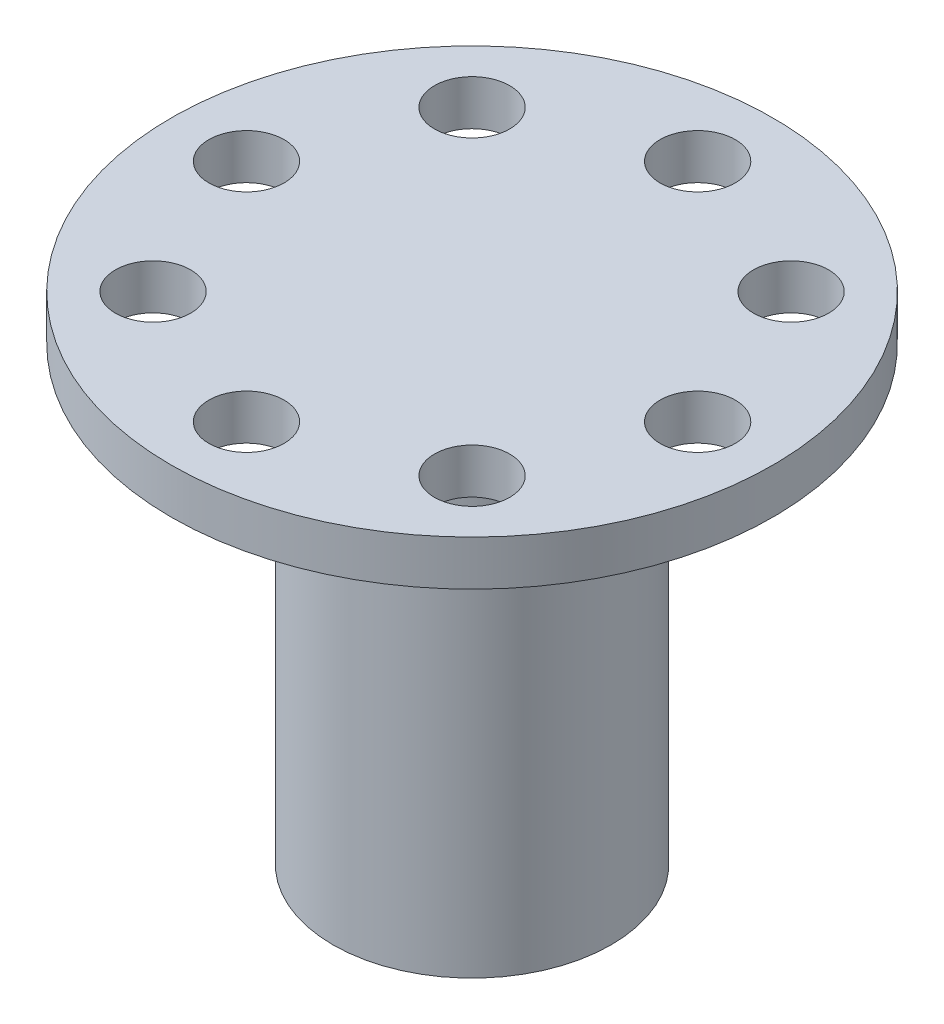
from build123d import *

# Parameters (mm, degrees)
SKETCH1_R           = 20
SKETCH1_R_2         = 10
BOSS_EXTRUDE1_DEPTH = 3
SKETCH2_R           = 2.5
CUT_EXTRUDE1_DEPTH  = 3
SKETCH3_R           = 9.25
SKETCH3_R_2         = 7.25
BOSS_EXTRUDE2_DEPTH = 30


with BuildPart() as part:
    # Sketch1 → Boss-Extrude1 (new body)
    # profile 1 of 2: a face of its own
    with BuildSketch(Plane(origin=(0, 0, 0), x_dir=(1, 0, 0), z_dir=(0, 1, 0))):
        with Locations(Location((0, 0, 0), (0, 0, 270))):
            Circle(SKETCH1_R)
        Circle(SKETCH1_R_2, mode=Mode.SUBTRACT)
    # profile 2 of 2: a face of its own
    with BuildSketch(Plane(origin=(0, 0, 0), x_dir=(1, 0, 0), z_dir=(0, 1, 0))):
        Circle(SKETCH1_R_2)
    extrude(amount=BOSS_EXTRUDE1_DEPTH)

    # Sketch2 → Cut-Extrude1 (cut)
    with BuildSketch(Plane(origin=(0, 3, 0), x_dir=(1, 0, 0), z_dir=(0, 1, 0))):
        with Locations(Location((0, 15, 0), (0, 0, 270))):
            Circle(SKETCH2_R)
        with Locations(Location((10.606601718, 10.606601718, 0), (0, 0, 270))):
            Circle(SKETCH2_R)
        with Locations(Location((15, 0, 0), (0, 0, 270))):
            Circle(SKETCH2_R)
        with Locations(Location((10.606601718, -10.606601718, 0), (0, 0, 270))):
            Circle(SKETCH2_R)
        with Locations(Location((0, -15, 0), (0, 0, 270))):
            Circle(SKETCH2_R)
        with Locations(Location((-10.606601718, -10.606601718, 0), (0, 0, 270))):
            Circle(SKETCH2_R)
        with Locations(Location((-15, 0, 0), (0, 0, 270))):
            Circle(SKETCH2_R)
        with Locations(Location((-10.606601718, 10.606601718, 0), (0, 0, 270))):
            Circle(SKETCH2_R)
    extrude(amount=-CUT_EXTRUDE1_DEPTH, mode=Mode.SUBTRACT)

    # Sketch3 → Boss-Extrude2 (add)
    with BuildSketch(Plane.XZ):
        with Locations(Location((0, 0, 0), (0, 0, 90))):
            Circle(SKETCH3_R)
        with Locations(Location((0, 0, 0), (0, 0, 270))):
            Circle(SKETCH3_R_2, mode=Mode.SUBTRACT)
    extrude(amount=BOSS_EXTRUDE2_DEPTH)


solid = part.part
